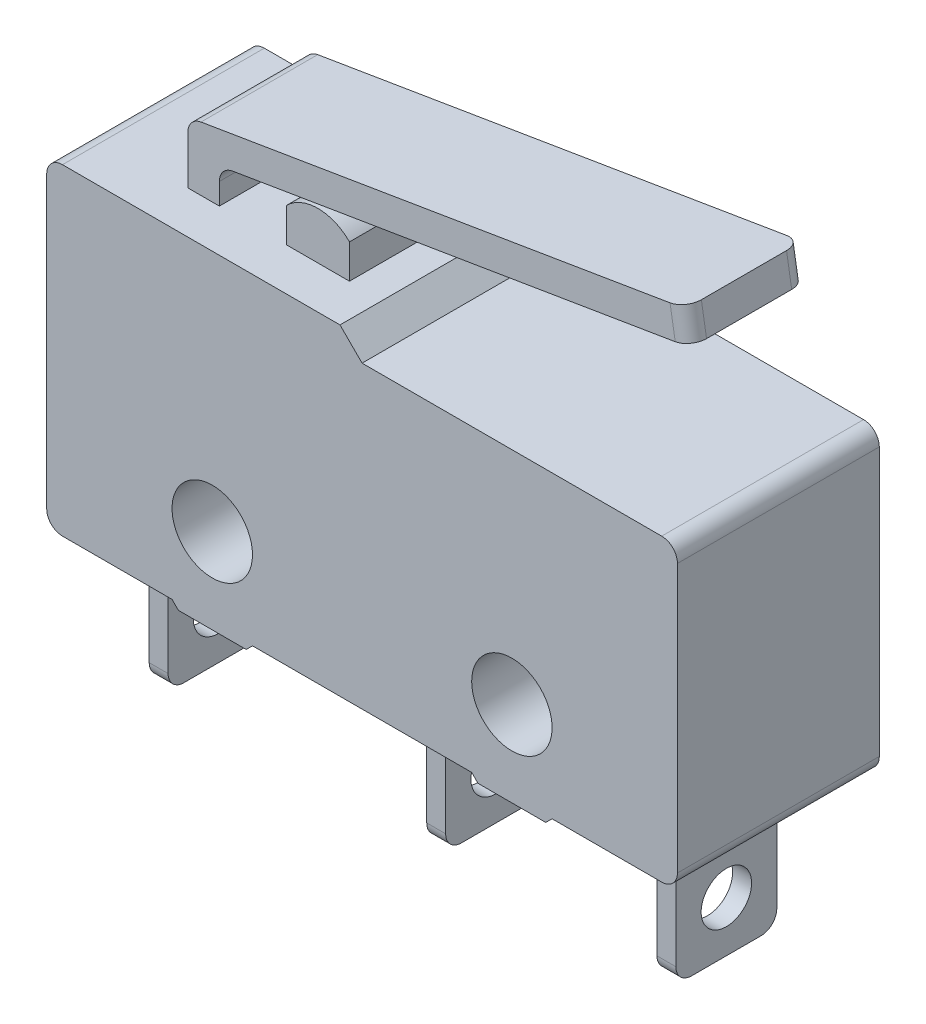
from build123d import *

# Parameters (mm, degrees)
SKETCH_1_R               = 1.275
EXTRUDE_1_DEPTH          = 6.4
FILLET_1_R               = 0.5
EXTRUDE_2_DEPTH          = 1.6
EXTRUDE_2_DEPTH_BACK     = 1.6
SKETCH_2_W               = 0.6
SKETCH_2_H               = 4.2
EXTRUDE_3_DEPTH          = 1.85
EXTRUDE_3_DEPTH_BACK     = 1.85
EXTRUDE_7_DEPTH          = 1.85
EXTRUDE_7_DEPTH_BACK     = 1.85
FILLET_2_R               = 0.5
FILLET_3_R               = 0.5
CUT_EXTRUDE_1_DEPTH      = 16.536582441
CUT_EXTRUDE_1_DEPTH_BACK = 16.536582441
SKETCH_5_R               = 0.8


with BuildPart() as part:
    # 草图1 → 凸台-拉伸1 (new body)
    with BuildSketch(Plane.XY):
        with BuildLine():
            Line((-10, -4.75), (-10, 4.75))
            Line((-10, 4.75), (-10, 4.95))
            ThreePointArc((-10, 4.95), (-9.853553391, 5.303553391), (-9.5, 5.45))
            Line((-9.5, 5.45), (-0.7, 5.45))
            Line((-0.7, 5.45), (0, 4.75))
            Line((0, 4.75), (10, 4.75))
            Line((10, 4.75), (10, -4.75))
            Line((10, -4.75), (6.025, -4.75))
            Line((6.025, -4.75), (5.825, -4.95))
            Line((5.825, -4.95), (3.675, -4.95))
            Line((3.675, -4.95), (3.475, -4.75))
            Line((3.475, -4.75), (-3.475, -4.75))
            Line((-3.475, -4.75), (-3.675, -4.95))
            Line((-3.675, -4.95), (-5.825, -4.95))
            Line((-5.825, -4.95), (-6.025, -4.75))
            Line((-6.025, -4.75), (-10, -4.75))
        make_face()
        with Locations((-4.75, -2.25)):
            Circle(SKETCH_1_R, mode=Mode.SUBTRACT)
        with Locations(Location((4.75, -2.25, 0), (0, 0, 180))):
            Circle(SKETCH_1_R, mode=Mode.SUBTRACT)
    extrude(amount=EXTRUDE_1_DEPTH)

    # 圆角1
    fillet_1_edges = [part.edges().sort_by_distance(p)[0] for p in [
        (10, 4.75, 3.2),
        (10, -4.75, 3.2),
        (-10, -4.75, 3.2),
    ]]
    fillet(fillet_1_edges, radius=FILLET_1_R)

    # 草图2 → 凸台-拉伸2 (add, two sides: drawn at the far end of the back side and taken through both)
    with BuildSketch(Plane.XY.offset(3.2).offset(-EXTRUDE_2_DEPTH_BACK)):
        with Locations((-8.05, -6.85)):
            Rectangle(SKETCH_2_W, SKETCH_2_H)
        with Locations((0.75, -6.85)):
            Rectangle(SKETCH_2_W, SKETCH_2_H)
        with Locations((8.05, -6.85)):
            Rectangle(SKETCH_2_W, SKETCH_2_H)
    extrude(amount=EXTRUDE_2_DEPTH + EXTRUDE_2_DEPTH_BACK)

    # 草图3 → 凸台-拉伸3 (add, two sides: drawn at the far end of the back side and taken through both)
    with BuildSketch(Plane.XY.offset(3.2).offset(-EXTRUDE_3_DEPTH_BACK)):
        with BuildLine():
            ThreePointArc((-3.75, 6.529795897), (-2.75, 6.95), (-1.75, 6.529795897))
            Line((-1.75, 6.529795897), (-1.75, 5.45))
            Line((-1.75, 5.45), (-3.75, 5.45))
            Line((-3.75, 5.45), (-3.75, 6.529795897))
        make_face()
    extrude(amount=EXTRUDE_3_DEPTH + EXTRUDE_3_DEPTH_BACK)

    # 草图4 → 凸台-拉伸7 (add, two sides: drawn at the far end of the back side and taken through both)
    with BuildSketch(Plane.XY.offset(3.2).offset(-EXTRUDE_7_DEPTH_BACK)):
        Polygon((-2.796894142, 8.076477611), (-6.875, 7.398937263), (-6.875, 5.45), (-6.875, 4.395314544), (-5.875, 4.395314544), (-5.875, 5.45), (-5.875, 6.45), (-5.875, 6.551370746), (9.072540681, 9.03476923), (8.908646315, 10.021247125), align=None)
    extrude(amount=EXTRUDE_7_DEPTH + EXTRUDE_7_DEPTH_BACK)

    # 圆角2
    fillet_2_edges = [part.edges().sort_by_distance(p)[0] for p in [
        (-5.875, 6.551370746, 3.2),
        (8.990593498, 9.528008177, 5.05),
        (-6.875, 7.398937263, 3.2),
        (8.990593498, 9.528008177, 1.35),
    ]]
    fillet(fillet_2_edges, radius=FILLET_2_R)

    # 圆角3
    fillet_3_edges = [part.edges().sort_by_distance(p)[0] for p in [
        (-8.05, -8.95, 1.6),
        (-8.05, -8.95, 4.8),
        (0.75, -8.95, 1.6),
        (0.75, -8.95, 4.8),
        (8.05, -8.95, 1.6),
        (8.05, -8.95, 4.8),
    ]]
    fillet(fillet_3_edges, radius=FILLET_3_R)

    # 草图5 → 切除-拉伸1 (cut, two sides: drawn at the far end of the back side and taken through both)
    with BuildSketch(Plane(origin=(0, 0, 0), x_dir=(0, 0, -1), z_dir=(1, 0, 0)).offset(-CUT_EXTRUDE_1_DEPTH_BACK)):
        with Locations((-3.2, -7.35)):
            Circle(SKETCH_5_R)
    extrude(amount=CUT_EXTRUDE_1_DEPTH + CUT_EXTRUDE_1_DEPTH_BACK, mode=Mode.SUBTRACT)


solid = part.part
